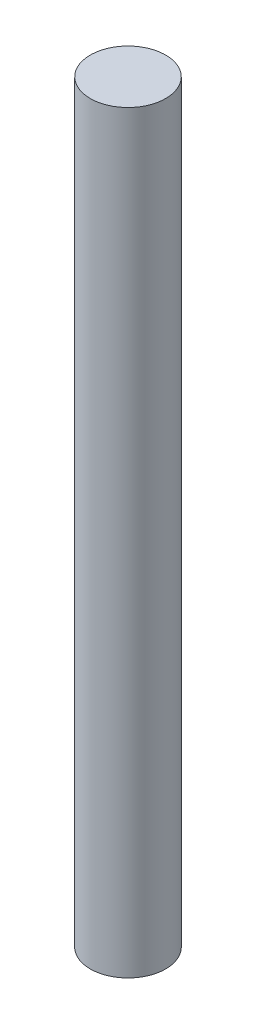
from build123d import *

# Parameters (mm, degrees)
SKETCH_1_R      = 2.5
EXTRUDE_1_DEPTH = 50


with BuildPart() as part:
    # 草图1 → 凸台-拉伸1 (new body)
    with BuildSketch(Plane(origin=(0, 0, 0), x_dir=(1, 0, 0), z_dir=(0, 1, 0))):
        with Locations(Location((0, 0, 0), (0, 0, 270))):
            Circle(SKETCH_1_R)
    extrude(amount=EXTRUDE_1_DEPTH)


solid = part.part
